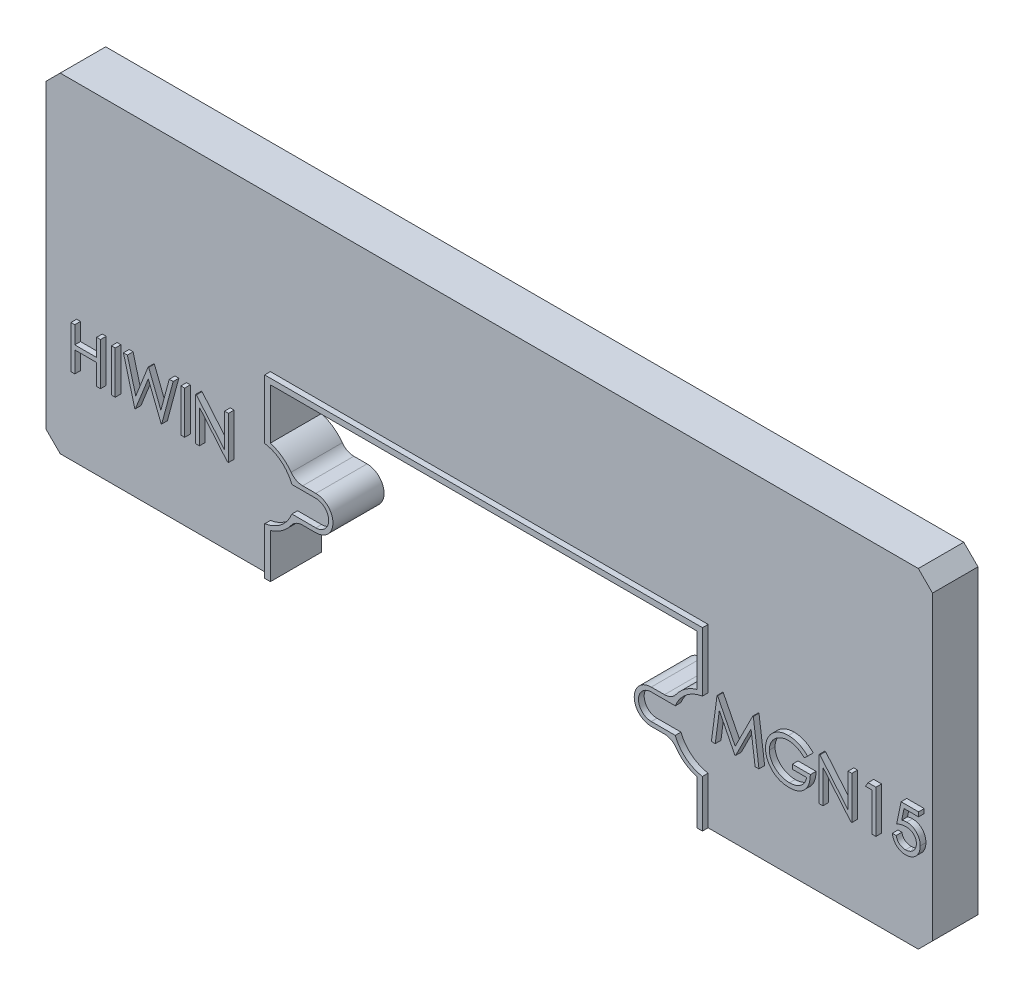
from build123d import *

# Parameters (mm, degrees)
BOSS_EXTRUDE1_DEPTH = 1.6
FILLET1_R           = 0.5
BOSS_EXTRUDE3_START = 0.2
BOSS_EXTRUDE3_DEPTH = 0.2
SKETCH3_W           = 0.134615385
SKETCH3_H           = 1.5
SKETCH3_W_2         = 0.134615384
BOSS_EXTRUDE4_DEPTH = 0.2


with BuildPart() as part:
    # Sketch1 → Boss-Extrude1 (new body)
    with BuildSketch(Plane.XY):
        with BuildLine():
            ThreePointArc((6.647274571, -2.31), (6.997318767, -1.854307057), (7.501849233, -1.579287046))
            Line((7.501849233, -1.579287046), (7.501849233, 0.2))
            Line((7.501849233, 0.2), (-7.501849233, 0.2))
            Line((-7.501849233, 0.2), (-7.501849233, -1.579287046))
            ThreePointArc((-7.501849233, -1.579287046), (-6.997318767, -1.854307057), (-6.647274571, -2.31))
            Line((-6.647274571, -2.31), (-5.9, -2.31))
            ThreePointArc((-5.9, -2.31), (-5.3, -2.91), (-5.9, -3.51))
            Line((-5.9, -3.51), (-6.647274571, -3.51))
            ThreePointArc((-6.647274571, -3.51), (-6.996585307, -3.96506535), (-7.5, -4.240158261))
            Line((-7.5, -4.240158261), (-7.5, -5.8))
            Line((-7.5, -5.8), (-15.095, -5.8))
            Line((-15.095, -5.8), (-15.595, -5.3))
            Line((-15.595, -5.3), (-15.595, 5.3))
            Line((-15.595, 5.3), (-15.095, 5.8))
            Line((-15.095, 5.8), (15.095, 5.8))
            Line((15.095, 5.8), (15.595, 5.3))
            Line((15.595, 5.3), (15.595, -5.3))
            Line((15.595, -5.3), (15.095, -5.8))
            Line((15.095, -5.8), (7.5, -5.8))
            Line((7.5, -5.8), (7.5, -4.240158261))
            ThreePointArc((7.5, -4.240158261), (6.996585307, -3.96506535), (6.647274571, -3.51))
            Line((6.647274571, -3.51), (5.9, -3.51))
            ThreePointArc((5.9, -3.51), (5.3, -2.91), (5.9, -2.31))
            Line((5.9, -2.31), (6.647274571, -2.31))
        make_face()
    extrude(amount=-BOSS_EXTRUDE1_DEPTH)

    # Fillet1
    fillet1_edges = [part.edges().sort_by_distance(p)[0] for p in [
        (-6.647274571, -2.31, -0.8),
        (-6.647274571, -3.51, -0.8),
        (6.647274571, -3.51, -0.8),
        (6.647274571, -2.31, -0.8),
    ]]
    fillet(fillet1_edges, radius=FILLET1_R)

    # Sketch2 → Boss-Extrude3 (add)
    with BuildSketch(Plane.XY.offset(BOSS_EXTRUDE3_START)):
        with BuildLine():
            Line((-7.7, -5.8), (-7.5, -5.8))
            Line((-7.5, -5.8), (-7.5, -4.240158261))
            ThreePointArc((-7.5, -4.240158261), (-7.092189431, -4.039939416), (-6.770797719, -3.718840656))
            ThreePointArc((-6.770797719, -3.718840656), (-6.592812851, -3.565264308), (-6.364317416, -3.51))
            Line((-6.364317416, -3.51), (-5.9, -3.51))
            ThreePointArc((-5.9, -3.51), (-5.3, -2.91), (-5.9, -2.31))
            Line((-5.9, -2.31), (-6.364317416, -2.31))
            ThreePointArc((-6.364317416, -2.31), (-6.592812851, -2.254735692), (-6.770797719, -2.101159344))
            ThreePointArc((-6.770797719, -2.101159344), (-7.092974903, -1.779499451), (-7.501849233, -1.579287046))
            Line((-7.501849233, -1.579287046), (-7.501849233, 0.2))
            Line((-7.501849233, 0.2), (7.501849233, 0.2))
            Line((7.501849233, 0.2), (7.501849233, -1.579287046))
            ThreePointArc((7.501849233, -1.579287046), (7.092974903, -1.779499451), (6.770797719, -2.101159344))
            ThreePointArc((6.770797719, -2.101159344), (6.592812851, -2.254735692), (6.364317416, -2.31))
            Line((6.364317416, -2.31), (5.9, -2.31))
            ThreePointArc((5.9, -2.31), (5.3, -2.91), (5.9, -3.51))
            Line((5.9, -3.51), (6.364317416, -3.51))
            ThreePointArc((6.364317416, -3.51), (6.592812851, -3.565264308), (6.770797719, -3.718840656))
            ThreePointArc((6.770797719, -3.718840656), (7.092189431, -4.039939416), (7.5, -4.240158261))
            Line((7.5, -4.240158261), (7.5, -5.8))
            Line((7.5, -5.8), (7.7, -5.8))
            Line((7.7, -5.8), (7.7, -4.133764683))
            ThreePointArc((7.7, -4.133764683), (7.119615817, -3.87363921), (6.744534726, -3.36))
            Line((6.744534726, -3.36), (5.9, -3.36))
            ThreePointArc((5.9, -3.36), (5.45, -2.91), (5.9, -2.46))
            Line((5.9, -2.46), (6.744534726, -2.46))
            ThreePointArc((6.744534726, -2.46), (7.120344028, -1.945771518), (7.701849233, -1.685934531))
            Line((7.701849233, -1.685934531), (7.701849233, 0.4))
            Line((7.701849233, 0.4), (-7.701849233, 0.4))
            Line((-7.701849233, 0.4), (-7.701849233, -1.685934531))
            ThreePointArc((-7.701849233, -1.685934531), (-7.120344028, -1.945771518), (-6.744534726, -2.46))
            Line((-6.744534726, -2.46), (-5.9, -2.46))
            ThreePointArc((-5.9, -2.46), (-5.45, -2.91), (-5.9, -3.36))
            Line((-5.9, -3.36), (-6.744534726, -3.36))
            ThreePointArc((-6.744534726, -3.36), (-7.119615817, -3.87363921), (-7.7, -4.133764683))
            Line((-7.7, -4.133764683), (-7.7, -5.8))
        make_face()
    extrude(amount=-BOSS_EXTRUDE3_DEPTH)

    # Sketch3 → Boss-Extrude4 (add)
    with BuildSketch(Plane.XY):
        Polygon((-10.132115385, -2.91), (-10.132115385, -1.41), (-10.103870192, -1.41), (-9.112884615, -2.590588942), (-9.112884615, -1.41), (-8.978269231, -1.41), (-8.978269231, -2.91), (-9.008918269, -2.91), (-9.9975, -1.732115385), (-9.9975, -2.91), align=None)
        with Locations((-10.584038462, -2.16)):
            Rectangle(SKETCH3_W, SKETCH3_H)
        Polygon((-12.670576923, -1.41), (-12.531454327, -1.41), (-12.237884615, -2.510060096), (-11.801286058, -1.41), (-11.781754808, -1.41), (-11.353269231, -2.502548077), (-11.058197115, -1.41), (-10.920576923, -1.41), (-11.325024038, -2.91), (-11.344254808, -2.91), (-11.795576923, -1.762764423), (-12.252307692, -2.91), (-12.271538462, -2.91), align=None)
        with Locations((-13.026346154, -2.16)):
            Rectangle(SKETCH3_W_2, SKETCH3_H)
        Polygon((-14.516730769, -1.41), (-14.382115385, -1.41), (-14.382115385, -2.025384615), (-13.612884615, -2.025384615), (-13.612884615, -1.41), (-13.478269231, -1.41), (-13.478269231, -2.91), (-13.612884615, -2.91), (-13.612884615, -2.179230769), (-14.382115385, -2.179230769), (-14.382115385, -2.91), (-14.516730769, -2.91), align=None)
        Polygon((8.015384615, -2.91), (8.213401442, -1.41), (8.232632212, -1.41), (8.851923077, -2.640769231), (9.469711538, -1.41), (9.489242788, -1.41), (9.688461538, -2.91), (9.553245192, -2.91), (9.409615385, -1.830673077), (8.868149038, -2.91), (8.837800481, -2.91), (8.294230769, -1.828269231), (8.150901442, -2.91), align=None)
        with BuildLine():
            Line((11.4, -1.666009615), (11.284615385, -1.775384615))
            add(Edge.make_bspline(
                [(11.284615385, -1.775384615), (11.263735861, -1.755742817), (11.222474698, -1.71692759), (11.155206023, -1.666565735), (11.085021608, -1.623423121), (11.012287681, -1.588320448), (10.938805444, -1.560312122), (10.865550254, -1.54037149), (10.793273525, -1.527654689), (10.74520186, -1.526133959), (10.721514423, -1.525384615)],
                knots=[0, 0, 0, 0, 1.08915593, 2.152340314, 3.188132944, 4.216796309, 5.218260357, 6.173443236, 7.099959455, 8, 8, 8, 8], degree=3))
            add(Edge.make_bspline(
                [(10.721514423, -1.525384615), (10.706979552, -1.525561875), (10.677947506, -1.525915935), (10.634823815, -1.530434884), (10.5921524, -1.536934112), (10.55001381, -1.546337773), (10.508326116, -1.558255942), (10.467234305, -1.573163997), (10.426661725, -1.590544816), (10.386990547, -1.610628734), (10.348530331, -1.632691525), (10.312205973, -1.6571409), (10.277785945, -1.683193238), (10.245917191, -1.711500801), (10.216416397, -1.741807172), (10.18858138, -1.773548588), (10.163391111, -1.807592254), (10.140637754, -1.843311808), (10.120339918, -1.880079889), (10.102421924, -1.917542599), (10.087380314, -1.955575679), (10.075479119, -1.994226855), (10.065660268, -2.033197108), (10.058752722, -2.072756274), (10.054858412, -2.11294671), (10.054184792, -2.139859821), (10.053846154, -2.153389423)],
                knots=[0, 0, 0, 0, 1.02818874, 2.053710826, 3.065248034, 4.081641283, 5.106893873, 6.131558223, 7.173050175, 8.228653731, 9.27666206, 10.308777013, 11.325269123, 12.329503258, 13.32196095, 14.316845687, 15.314881793, 16.315733098, 17.311955233, 18.285320748, 19.252783886, 20.203351036, 21.145449891, 22.095197417, 23.042428769, 24, 24, 24, 24], degree=3))
            add(Edge.make_bspline(
                [(10.053846154, -2.153389423), (10.054170033, -2.167219773), (10.054816907, -2.194842708), (10.058957044, -2.236068739), (10.066640576, -2.276682483), (10.076912451, -2.316817397), (10.089761372, -2.356542217), (10.105778229, -2.395684722), (10.124749201, -2.434243461), (10.146707723, -2.471871011), (10.170787524, -2.508523735), (10.19776313, -2.543049244), (10.226417666, -2.575907292), (10.257795052, -2.606368333), (10.290889141, -2.635247146), (10.326688688, -2.661748084), (10.364489743, -2.686381608), (10.404349976, -2.70883726), (10.445836883, -2.728898061), (10.488375492, -2.746736873), (10.532101698, -2.761428018), (10.576785708, -2.773401491), (10.622374253, -2.783215904), (10.66909874, -2.789529824), (10.716615615, -2.794111609), (10.748646457, -2.79444661), (10.764783654, -2.794615385)],
                knots=[0, 0, 0, 0, 0.93586088, 1.869166235, 2.799637598, 3.729985548, 4.670839027, 5.622275134, 6.589130586, 7.576015415, 8.568469353, 9.55398029, 10.53834874, 11.515998671, 12.510579167, 13.508179873, 14.527009472, 15.561807829, 16.601455013, 17.643573243, 18.680854198, 19.719860599, 20.772568776, 21.833555941, 22.908541556, 24, 24, 24, 24], degree=3))
            add(Edge.make_bspline(
                [(10.764783654, -2.794615385), (10.784231517, -2.794208852), (10.822420556, -2.793410559), (10.878557603, -2.787196149), (10.932473204, -2.77749038), (10.984015863, -2.763276425), (11.033245443, -2.745146278), (11.080342418, -2.723291113), (11.124935986, -2.696872659), (11.167160203, -2.667055287), (11.20605614, -2.633834645), (11.241136479, -2.597987021), (11.271841689, -2.559686421), (11.298629417, -2.519158429), (11.320790269, -2.476067584), (11.338980038, -2.430625057), (11.352922877, -2.382810409), (11.358646438, -2.349771138), (11.361538462, -2.333076923)],
                knots=[0, 0, 0, 0, 1.13008108, 2.219097802, 3.278683437, 4.311054135, 5.322181354, 6.324827112, 7.324222904, 8.330512327, 9.32562643, 10.293043162, 11.24128371, 12.174520618, 13.111833804, 14.052305215, 15.015860969, 16, 16, 16, 16], degree=3))
            Line((11.361538462, -2.333076923), (10.861538462, -2.333076923))
            Line((10.861538462, -2.333076923), (10.861538462, -2.179230769))
            Line((10.861538462, -2.179230769), (11.496153846, -2.179230769))
            add(Edge.make_bspline(
                [(11.496153846, -2.179230769), (11.495422768, -2.207905407), (11.493991917, -2.264026854), (11.483955239, -2.345871256), (11.467748162, -2.42317341), (11.445608028, -2.496014726), (11.416947194, -2.56429198), (11.382073253, -2.628074494), (11.340428058, -2.686950215), (11.293495012, -2.741399788), (11.240823602, -2.78996945), (11.18383705, -2.832657709), (11.122441207, -2.868615973), (11.056694146, -2.897870543), (10.986811103, -2.920702255), (10.912630369, -2.936890073), (10.83425254, -2.946588629), (10.780536822, -2.947827792), (10.753064904, -2.948461538)],
                knots=[0, 0, 0, 0, 1.140356446, 2.231883559, 3.274166699, 4.278491846, 5.25512956, 6.21435461, 7.1637429, 8.11826594, 9.068280886, 10.0076534, 10.945064095, 11.891975133, 12.864533718, 13.863980011, 14.907571808, 16, 16, 16, 16], degree=3))
            add(Edge.make_bspline(
                [(10.753064904, -2.948461538), (10.736131989, -2.948217629), (10.702734823, -2.947736562), (10.653410139, -2.944317699), (10.605445445, -2.939054595), (10.558847727, -2.931106685), (10.51344558, -2.921371833), (10.469465758, -2.908906096), (10.426740725, -2.894476654), (10.385204446, -2.878064222), (10.345233926, -2.859047798), (10.306651133, -2.837915095), (10.269242793, -2.814775083), (10.233263723, -2.789227578), (10.198526456, -2.761463667), (10.16525498, -2.731427701), (10.133263033, -2.699211507), (10.113222834, -2.676334789), (10.103125, -2.664807692)],
                knots=[0, 0, 0, 0, 1.107784379, 2.184907829, 3.233506516, 4.263428166, 5.276301166, 6.270063455, 7.25232949, 8.225834625, 9.190232166, 10.146266622, 11.1027726, 12.066435141, 13.031522626, 14.010570082, 14.99756817, 16, 16, 16, 16], degree=3))
            add(Edge.make_bspline(
                [(10.103125, -2.664807692), (10.088473886, -2.64652027), (10.059414852, -2.610248977), (10.022009928, -2.552134715), (9.990123613, -2.491962489), (9.964251689, -2.429564791), (9.944049652, -2.364999985), (9.929561258, -2.298350575), (9.92107242, -2.229530733), (9.919849475, -2.182959906), (9.919230769, -2.159399038)],
                knots=[0, 0, 0, 0, 1.023165419, 2.029347347, 3.013907458, 3.994755782, 4.975994455, 5.96558838, 6.970761222, 8, 8, 8, 8], degree=3))
            add(Edge.make_bspline(
                [(9.919230769, -2.159399038), (9.919458871, -2.141756359), (9.919912176, -2.106695227), (9.925408826, -2.054642095), (9.933295148, -2.003513227), (9.944886743, -1.953350417), (9.959499428, -1.904120164), (9.977736636, -1.855799608), (9.998970163, -1.808360234), (10.023649661, -1.762128576), (10.05111443, -1.717718114), (10.080921667, -1.675307627), (10.113494639, -1.635669456), (10.14830141, -1.598301607), (10.185757263, -1.563673529), (10.225511301, -1.531464625), (10.267594163, -1.501631688), (10.31213824, -1.474644616), (10.358478676, -1.450403064), (10.406504391, -1.429150545), (10.456200724, -1.411586267), (10.507195357, -1.396683219), (10.559874286, -1.385662444), (10.613855231, -1.377670125), (10.669419564, -1.372201296), (10.706977863, -1.371761472), (10.726021635, -1.371538462)],
                knots=[0, 0, 0, 0, 1.008945113, 2.00506715, 2.99143336, 3.967273523, 4.948097931, 5.927297278, 6.919902385, 7.919676788, 8.923139349, 9.905703106, 10.883022732, 11.856032218, 12.825136022, 13.798837087, 14.781400844, 15.773989409, 16.776158564, 17.77167057, 18.775803737, 19.789618931, 20.80898985, 21.851988756, 22.910860228, 24, 24, 24, 24], degree=3))
            add(Edge.make_bspline(
                [(10.726021635, -1.371538462), (10.74155231, -1.371786815), (10.772347816, -1.372279271), (10.818173129, -1.375692692), (10.863290136, -1.381102927), (10.907765731, -1.388485835), (10.95144846, -1.398541702), (10.994462762, -1.410575253), (11.036870992, -1.424586034), (11.078540242, -1.44129554), (11.119750691, -1.460261379), (11.16073148, -1.481609989), (11.201342586, -1.505706419), (11.241654435, -1.53262222), (11.281921231, -1.561895113), (11.321506078, -1.594362324), (11.361364482, -1.628743505), (11.386993831, -1.653464441), (11.4, -1.666009615)],
                knots=[0, 0, 0, 0, 0.985871117, 1.954866573, 2.915460327, 3.869826059, 4.81536089, 5.759505086, 6.70452669, 7.649098992, 8.607881297, 9.583363685, 10.581137262, 11.603961102, 12.659522466, 13.73993555, 14.853081303, 16, 16, 16, 16], degree=3))
        make_face()
        Polygon((11.803846154, -2.91), (11.803846154, -1.41), (11.832091346, -1.41), (12.823076923, -2.590588942), (12.823076923, -1.41), (12.957692308, -1.41), (12.957692308, -2.91), (12.927043269, -2.91), (11.938461538, -1.732115385), (11.938461538, -2.91), align=None)
        Polygon((13.526502404, -1.41), (13.803846154, -1.41), (13.803846154, -2.91), (13.669230769, -2.91), (13.669230769, -1.563846154), (13.438461538, -1.563846154), align=None)
        with BuildLine():
            Line((15.303846154, -1.41), (15.303846154, -1.563846154))
            Line((15.303846154, -1.563846154), (14.793629808, -1.563846154))
            Line((14.793629808, -1.563846154), (14.712800481, -1.958377404))
            add(Edge.make_bspline(
                [(14.712800481, -1.958377404), (14.72868157, -1.953993002), (14.759448668, -1.945498916), (14.804860037, -1.936067871), (14.847970981, -1.930382681), (14.87594614, -1.929606405), (14.889483173, -1.929230769)],
                knots=[0, 0, 0, 0, 1.100273476, 2.13160584, 3.095893838, 4, 4, 4, 4], degree=3))
            add(Edge.make_bspline(
                [(14.889483173, -1.929230769), (14.906233347, -1.929593313), (14.939168375, -1.930306165), (14.987356495, -1.937151243), (15.033356306, -1.947925492), (15.077071608, -1.962977145), (15.118583272, -1.982224173), (15.15750937, -2.006267005), (15.19443419, -2.034352718), (15.228695302, -2.066643437), (15.259777148, -2.102181273), (15.287105429, -2.140391789), (15.310317968, -2.180903645), (15.328986863, -2.224103905), (15.343894435, -2.269514971), (15.353816718, -2.317614649), (15.360423879, -2.367949558), (15.361162045, -2.402365802), (15.361538462, -2.419915865)],
                knots=[0, 0, 0, 0, 1.052922333, 2.070308379, 3.05430497, 4.020497103, 4.973039431, 5.925935799, 6.892292201, 7.88610001, 8.88166317, 9.857072816, 10.836096531, 11.812156883, 12.81219415, 13.836441305, 14.89672472, 16, 16, 16, 16], degree=3))
            add(Edge.make_bspline(
                [(15.361538462, -2.419915865), (15.361253429, -2.432139674), (15.360687217, -2.456422097), (15.357807822, -2.492483898), (15.352263944, -2.527782255), (15.344820633, -2.562321851), (15.335159597, -2.596037296), (15.323464288, -2.629025094), (15.309151705, -2.661079926), (15.293452544, -2.692505095), (15.275775482, -2.722590169), (15.256156122, -2.750725449), (15.235428054, -2.777332999), (15.213124603, -2.802127456), (15.189038463, -2.824945892), (15.163461334, -2.845923727), (15.136597312, -2.865415725), (15.108030779, -2.882630666), (15.078398286, -2.898471933), (15.047271908, -2.911467735), (15.015360179, -2.923086533), (14.982203804, -2.932347759), (14.947877884, -2.939604568), (14.912325837, -2.944533397), (14.875734122, -2.948123298), (14.850930545, -2.948348023), (14.838401442, -2.948461538)],
                knots=[0, 0, 0, 0, 1.056347294, 2.098418968, 3.122841568, 4.141288669, 5.149314143, 6.15115421, 7.162517403, 8.180376062, 9.185164535, 10.17417709, 11.141909838, 12.097768115, 13.052685741, 14.0056014, 14.954263652, 15.917497458, 16.885230207, 17.854509472, 18.828990115, 19.81800267, 20.826176721, 21.857883937, 22.917946725, 24, 24, 24, 24], degree=3))
            add(Edge.make_bspline(
                [(14.838401442, -2.948461538), (14.823455365, -2.948165465), (14.794050723, -2.947582976), (14.75097048, -2.941489339), (14.709521363, -2.932761946), (14.670037034, -2.919632116), (14.632163636, -2.903180419), (14.596411042, -2.882387774), (14.56186571, -2.858825301), (14.52993198, -2.831019435), (14.500293645, -2.800627), (14.473762284, -2.767645154), (14.450133609, -2.73261825), (14.429786003, -2.695376184), (14.412429708, -2.656016814), (14.398794713, -2.61439267), (14.387789704, -2.57072124), (14.383133952, -2.54065545), (14.380769231, -2.525384615)],
                knots=[0, 0, 0, 0, 1.0467383, 2.05933395, 3.04377827, 4.011590433, 4.970194871, 5.932262533, 6.905835911, 7.896367577, 8.894135286, 9.877477877, 10.858688626, 11.851381753, 12.8477658, 13.868841284, 14.917554742, 16, 16, 16, 16], degree=3))
            Line((14.380769231, -2.525384615), (14.515384615, -2.525384615))
            add(Edge.make_bspline(
                [(14.515384615, -2.525384615), (14.518696854, -2.539688809), (14.525063161, -2.567182264), (14.539037054, -2.605809982), (14.556122429, -2.640232506), (14.576438578, -2.670905185), (14.600674306, -2.697651898), (14.628329775, -2.721487782), (14.659335942, -2.742991409), (14.693790183, -2.760915452), (14.730138646, -2.77620206), (14.768181736, -2.786381358), (14.806883599, -2.793538884), (14.833060043, -2.794255353), (14.846213942, -2.794615385)],
                knots=[0, 0, 0, 0, 1.136247022, 2.183929868, 3.172523383, 4.106158343, 5.02341133, 5.958108904, 6.928429099, 7.938127109, 8.96079061, 9.975095812, 10.982467395, 12, 12, 12, 12], degree=3))
            add(Edge.make_bspline(
                [(14.846213942, -2.794615385), (14.859053276, -2.794263623), (14.884334028, -2.793571), (14.921538908, -2.788239995), (14.957458711, -2.780029608), (14.991739007, -2.767742527), (15.024979667, -2.752809076), (15.056339854, -2.733645472), (15.086726801, -2.711591179), (15.115196002, -2.686324051), (15.141270051, -2.658479897), (15.164308389, -2.628703871), (15.183498495, -2.596939508), (15.199670256, -2.563736728), (15.211950241, -2.528731632), (15.220710661, -2.492088272), (15.225854829, -2.453716137), (15.226562478, -2.427543576), (15.226923077, -2.414206731)],
                knots=[0, 0, 0, 0, 1.027316725, 2.022795036, 3.002884548, 3.971462791, 4.93288096, 5.914575861, 6.907176829, 7.935150275, 8.956128384, 9.956726525, 10.942570165, 11.921478529, 12.907843606, 13.90538589, 14.932640048, 16, 16, 16, 16], degree=3))
            add(Edge.make_bspline(
                [(15.226923077, -2.414206731), (15.226640871, -2.402174266), (15.226088494, -2.378622428), (15.221575393, -2.344165625), (15.213725262, -2.311562892), (15.202829313, -2.280656792), (15.188995239, -2.251418174), (15.172089676, -2.223816863), (15.151795363, -2.198216648), (15.128613125, -2.174605554), (15.103216821, -2.152814893), (15.075169503, -2.134238856), (15.045058106, -2.118611463), (15.013245421, -2.105125178), (14.97897475, -2.095439144), (14.942924764, -2.088167193), (14.904706175, -2.083960609), (14.87857588, -2.083376943), (14.865144231, -2.083076923)],
                knots=[0, 0, 0, 0, 1.045622112, 2.046656509, 3.013763289, 3.955457236, 4.890082067, 5.820317437, 6.762574623, 7.722996705, 8.69280354, 9.665887285, 10.63943826, 11.638615906, 12.663482002, 13.728887084, 14.832589034, 16, 16, 16, 16], degree=3))
            add(Edge.make_bspline(
                [(14.865144231, -2.083076923), (14.853517547, -2.083325748), (14.829511395, -2.083839508), (14.792687326, -2.087622292), (14.753990873, -2.093724847), (14.713570375, -2.102118953), (14.671304443, -2.1131037), (14.627282272, -2.126267058), (14.5814113, -2.142005057), (14.550503704, -2.153890292), (14.534615385, -2.16)],
                knots=[0, 0, 0, 0, 0.817624296, 1.688186739, 2.600797293, 3.572016777, 4.590301741, 5.671205678, 6.80286297, 8, 8, 8, 8], degree=3))
            Line((14.534615385, -2.16), (14.688461538, -1.41))
            Line((14.688461538, -1.41), (15.303846154, -1.41))
        make_face()
    extrude(amount=BOSS_EXTRUDE4_DEPTH)


solid = part.part
